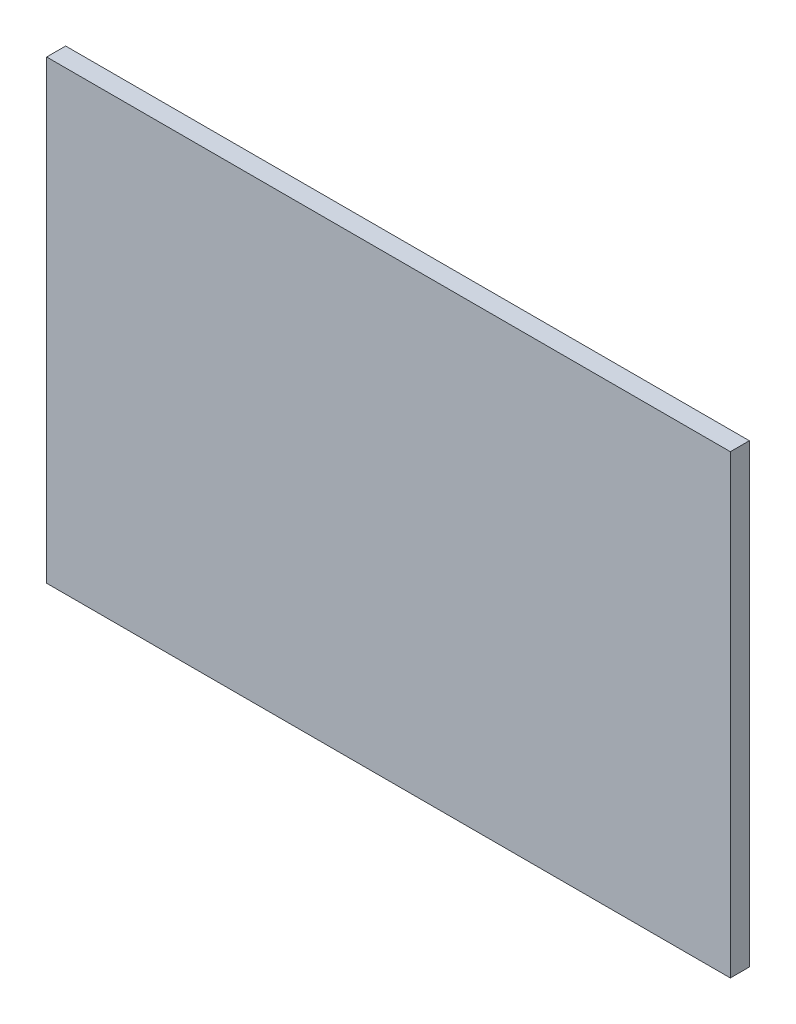
from build123d import *

# Parameters (mm, degrees)
SKETCH1_W           = 720
SKETCH1_H           = 480
BOSS_EXTRUDE1_DEPTH = 20


with BuildPart() as part:
    # Sketch1 → Boss-Extrude1 (new body)
    with BuildSketch(Plane.XY):
        with Locations((360, 240)):
            Rectangle(SKETCH1_W, SKETCH1_H)
    extrude(amount=BOSS_EXTRUDE1_DEPTH)


solid = part.part
